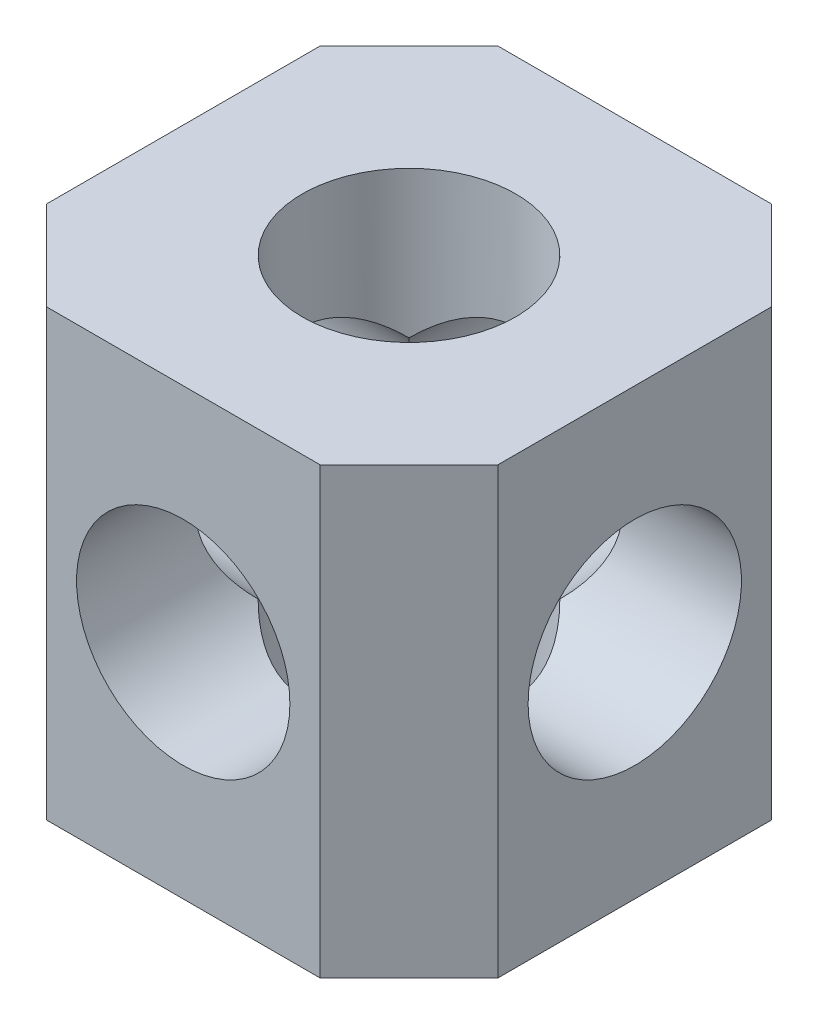
from build123d import *

# Parameters (mm, degrees)
SKETCH1_R           = 6
BOSS_EXTRUDE1_DEPTH = 15
SKETCH2_R           = 6
CUT_EXTRUDE1_DEPTH  = 32
SKETCH3_R           = 6
CUT_EXTRUDE2_DEPTH  = 32
BOSS_EXTRUDE2_DEPTH = 5
BOSS_EXTRUDE3_DEPTH = 5
CUT_EXTRUDE3_START  = -31
SKETCH8_R           = 6
CUT_EXTRUDE3_DEPTH  = 31


with BuildPart() as part:
    # Sketch1 → Boss-Extrude1 (new body)
    with BuildSketch(Plane(origin=(0, 0, 0), x_dir=(1, 0, 0), z_dir=(0, 1, 0))):
        Polygon((-7.7, 12.7), (-12.7, 7.7), (-12.7, -7.7), (-7.7, -12.7), (7.7, -12.7), (12.7, -7.7), (12.7, 7.7), (7.7, 12.7), align=None)
        with Locations(Location((0, 0, 0), (0, 0, 270))):
            Circle(SKETCH1_R, mode=Mode.SUBTRACT)
    extrude(amount=BOSS_EXTRUDE1_DEPTH)

    # Sketch2 → Cut-Extrude1 (cut)
    with BuildSketch(Plane.XY.offset(12.7)):
        with Locations((0, 7.5)):
            Circle(SKETCH2_R)
    extrude(amount=-CUT_EXTRUDE1_DEPTH, mode=Mode.SUBTRACT)

    # Sketch3 → Cut-Extrude2 (cut)
    with BuildSketch(Plane.ZY.offset(12.7)):
        with Locations((0, 7.5)):
            Circle(SKETCH3_R)
    extrude(amount=-CUT_EXTRUDE2_DEPTH, mode=Mode.SUBTRACT)

    # Sketch6 → Boss-Extrude2 (add)
    with BuildSketch(Plane(origin=(0, 15, 0), x_dir=(1, 0, 0), z_dir=(0, 1, 0))):
        Polygon((7.7, 12.7), (-7.7, 12.7), (-12.7, 7.7), (-12.7, -7.7), (-7.7, -12.7), (7.7, -12.7), (12.7, -7.7), (12.7, 7.7), align=None)
    extrude(amount=BOSS_EXTRUDE2_DEPTH)

    # Sketch7 → Boss-Extrude3 (add)
    with BuildSketch(Plane.XZ):
        Polygon((-7.7, -12.7), (7.7, -12.7), (12.7, -7.7), (12.7, 7.7), (7.7, 12.7), (-7.7, 12.7), (-12.7, 7.7), (-12.7, -7.7), align=None)
    extrude(amount=BOSS_EXTRUDE3_DEPTH)

    # Sketch8 → Cut-Extrude3 (cut)
    with BuildSketch(Plane(origin=(0, 20, 0), x_dir=(1, 0, 0), z_dir=(0, 1, 0)).offset(CUT_EXTRUDE3_START)):
        with Locations(Location((0, 0, 0), (0, 0, 135))):
            Circle(SKETCH8_R)
    extrude(amount=CUT_EXTRUDE3_DEPTH, mode=Mode.SUBTRACT)


solid = part.part
